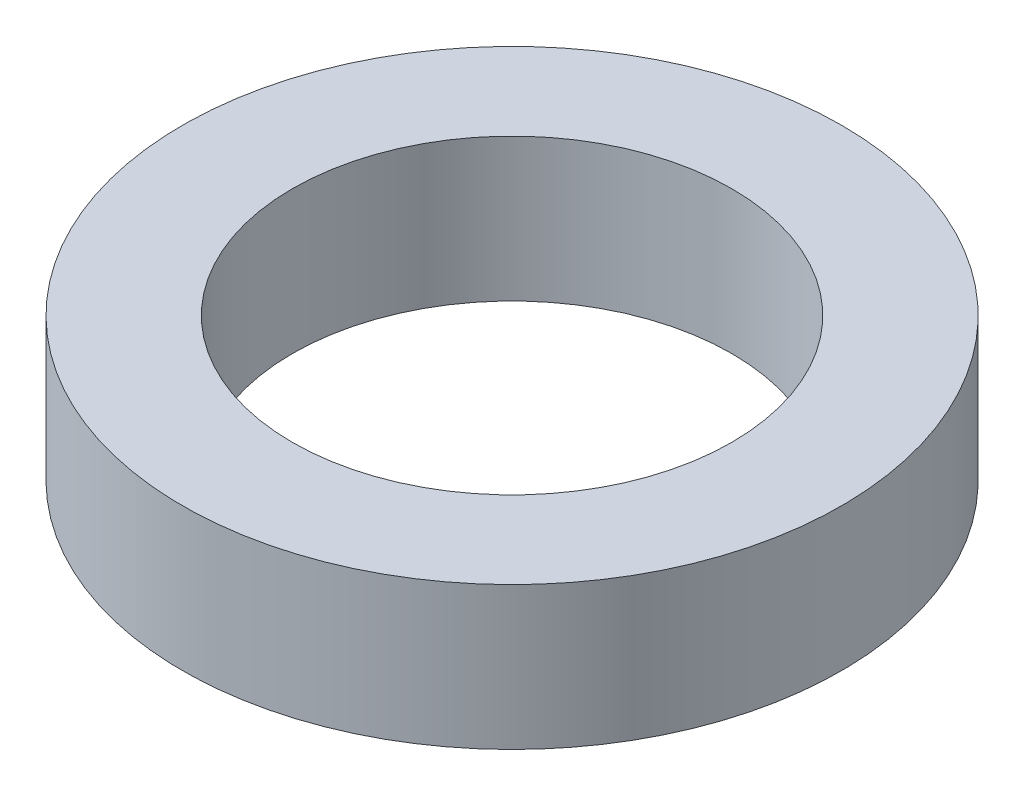
from build123d import *

# Parameters (mm, degrees)
SKETCH1_R           = 30
SKETCH1_R_2         = 20
BOSS_EXTRUDE1_DEPTH = 13


with BuildPart() as part:
    # Sketch1 → Boss-Extrude1 (new body)
    with BuildSketch(Plane(origin=(0, 0, 0), x_dir=(1, 0, 0), z_dir=(0, 1, 0))):
        with Locations(Location((0, 0, 0), (0, 0, 90))):
            Circle(SKETCH1_R)
        with Locations(Location((0, 0, 0), (0, 0, 90))):
            Circle(SKETCH1_R_2, mode=Mode.SUBTRACT)
    extrude(amount=BOSS_EXTRUDE1_DEPTH)


solid = part.part
